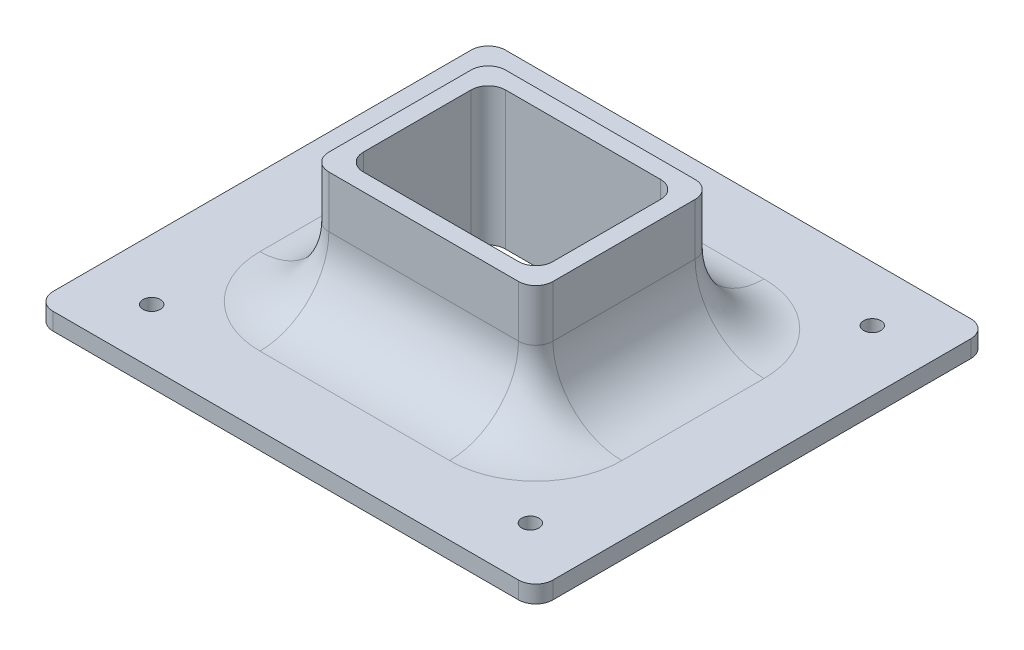
from build123d import *

# Parameters (mm, degrees)
SKETCH1_W           = 82.55
SKETCH1_H           = 65.0748
SKETCH1_W_2         = 69.85
SKETCH1_H_2         = 52.3748
BOSS_EXTRUDE1_DEPTH = 44.45
SKETCH2_W           = 184.15
SKETCH2_H           = 166.6748
BOSS_EXTRUDE4_DEPTH = 6.35
FILLET2_R           = 6.35
SKETCH3_R           = 3.175
CUT_EXTRUDE1_DEPTH  = 174.494911496
FILLET4_R           = 25.4
CUT_EXTRUDE2_DEPTH  = 174.494911496


with BuildPart() as part:
    # Sketch1 → Boss-Extrude1 (new body)
    with BuildSketch(Plane(origin=(0, 0, 0), x_dir=(1, 0, 0), z_dir=(0, 1, 0))):
        with Locations((34.925, 26.1874)):
            Rectangle(SKETCH1_W, SKETCH1_H)
        with Locations((34.925, 26.1874)):
            Rectangle(SKETCH1_W_2, SKETCH1_H_2, mode=Mode.SUBTRACT)
    extrude(amount=BOSS_EXTRUDE1_DEPTH)

    # Sketch2 → Boss-Extrude4 (add)
    with BuildSketch(Plane.XZ):
        with Locations((34.925, -26.1874)):
            Rectangle(SKETCH2_W, SKETCH2_H)
    extrude(amount=BOSS_EXTRUDE4_DEPTH)

    # Fillet2
    fillet2_edges = [part.edges().sort_by_distance(p)[0] for p in [
        (0, 22.225, -52.3748),
        (0, 22.225, 0),
        (69.85, 22.225, 0),
        (69.85, 22.225, -52.3748),
        (-57.15, -3.175, 57.15),
        (-57.15, -3.175, -109.5248),
        (127, -3.175, -109.5248),
        (127, -3.175, 57.15),
        (-6.35, 22.225, -58.7248),
        (76.2, 22.225, -58.7248),
        (76.2, 22.225, 6.35),
        (-6.35, 22.225, 6.35),
    ]]
    fillet(fillet2_edges, radius=FILLET2_R)

    # Sketch3 → Cut-Extrude1 (cut, through all)
    with BuildSketch(Plane(origin=(0, 0, 0), x_dir=(1, 0, 0), z_dir=(0, 1, 0))):
        with Locations(Location((104.670538096, 89.177877977, 0), (0, 0, 270))):
            Circle(SKETCH3_R)
        with Locations(Location((-34.820538096, -36.803077977, 0), (0, 0, 270))):
            Circle(SKETCH3_R)
        with Locations(Location((104.670538096, -36.803077977, 0), (0, 0, 270))):
            Circle(SKETCH3_R)
        with Locations(Location((-34.820538096, 89.177877977, 0), (0, 0, 270))):
            Circle(SKETCH3_R)
    extrude(amount=-CUT_EXTRUDE1_DEPTH, mode=Mode.SUBTRACT)

    # Fillet4
    fillet4_edges = [part.edges().sort_by_distance(p)[0] for p in [
        (-6.35, 0, -26.1874),
        (34.925, 0, -58.7248),
        (76.2, 0, -26.1874),
        (34.925, 0, 6.35),
        (-4.490128061, 0, -56.864928061),
        (-4.490128061, 0, 4.490128061),
        (74.340128061, 0, -56.864928061),
        (74.340128061, 0, 4.490128061),
    ]]
    fillet(fillet4_edges, radius=FILLET4_R)

    # Sketch4 → Cut-Extrude2 (cut, through all)
    with BuildSketch(Plane(origin=(0, 0, 0), x_dir=(1, 0, 0), z_dir=(0, 1, 0))):
        with BuildLine():
            Line((0, 46.0248), (0, 6.35))
            ThreePointArc((0, 6.35), (1.859871939, 1.859871939), (6.35, 0))
            Line((6.35, 0), (63.5, 0))
            ThreePointArc((63.5, 0), (67.990128061, 1.859871939), (69.85, 6.35))
            Line((69.85, 6.35), (69.85, 46.0248))
            ThreePointArc((69.85, 46.0248), (67.990128061, 50.514928061), (63.5, 52.3748))
            Line((63.5, 52.3748), (6.35, 52.3748))
            ThreePointArc((6.35, 52.3748), (1.859871939, 50.514928061), (0, 46.0248))
        make_face()
    extrude(amount=-CUT_EXTRUDE2_DEPTH, mode=Mode.SUBTRACT)


solid = part.part
